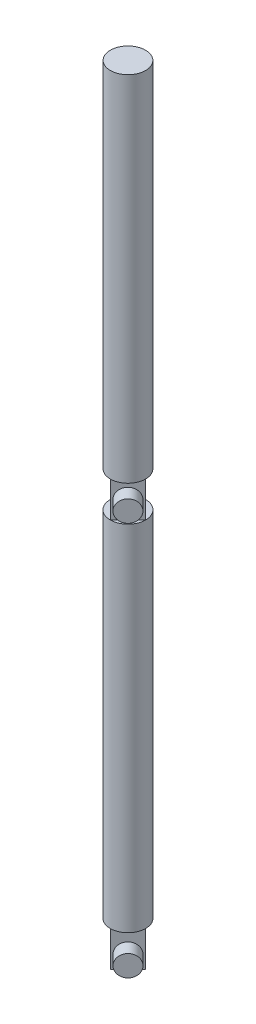
from build123d import *

# Parameters (mm, degrees)
SKETCH1_R                = 25
BOSS_EXTRUDE1_DEPTH      = 500
BOSS_EXTRUDE2_DEPTH      = 50
BOSS_EXTRUDE3_DEPTH      = 50
BOSS_EXTRUDE5_DEPTH      = 20
BOSS_EXTRUDE5_DEPTH_BACK = 55.4
SKETCH5_R                = 15
SKETCH8_R                = 24.878201485
BOSS_EXTRUDE6_DEPTH      = 500


with BuildPart() as part:
    # Sketch1 → Boss-Extrude1 (new body)
    with BuildSketch(Plane(origin=(0, 0, 0), x_dir=(1, 0, 0), z_dir=(0, 1, 0))):
        with Locations(Location((-21.996605786, 2.223061223, 0), (0, 0, 270))):
            Circle(SKETCH1_R)
    extrude(amount=BOSS_EXTRUDE1_DEPTH)

    # Sketch3 → Boss-Extrude2 (add)
    with BuildSketch(Plane(origin=(0, 500, 0), x_dir=(1, 0, 0), z_dir=(0, 1, 0))):
        Polygon((-46.996605786, 2.223061223), (-21.996605786, -22.776938777), (2.944600987, 2.164267995), (-22.055399013, 27.164267995), align=None)
    extrude(amount=BOSS_EXTRUDE2_DEPTH)

    # Sketch4 → Boss-Extrude3 (add)
    with BuildSketch(Plane(origin=(0, 0, 0), x_dir=(-1, 0, 0), z_dir=(0, -1, 0))):
        Polygon((46.996605786, 2.223061223), (21.996605786, 27.223061223), (-3.010340521, 2.216114917), (21.989659479, -22.783885083), align=None)
    extrude(amount=BOSS_EXTRUDE3_DEPTH)

    # Sketch5 → Boss-Extrude5 (add, two sides: drawn at the far end of the back side and taken through both)
    with BuildSketch(Plane(origin=(0.397112802, 0, 0.397112802), x_dir=(0.7071067811865474, 0, -0.7071067811865477), z_dir=(0.7071067811865477, 0, 0.7071067811865474)).offset(-BOSS_EXTRUDE5_DEPTH_BACK)):
        with Locations((-13.981523689, -31.399998411)):
            Circle(SKETCH5_R)
        with Locations((-14.023580538, 525)):
            Circle(SKETCH5_R)
    extrude(amount=BOSS_EXTRUDE5_DEPTH + BOSS_EXTRUDE5_DEPTH_BACK)

    # Sketch8 → Boss-Extrude6 (add)
    with BuildSketch(Plane(origin=(0, 550, 0), x_dir=(1, 0, 0), z_dir=(0, 1, 0))):
        with Locations(Location((-21.996605786, 2.223061223, 0), (0, 0, 89.990298588))):
            Circle(SKETCH8_R)
    extrude(amount=BOSS_EXTRUDE6_DEPTH)


solid = part.part
